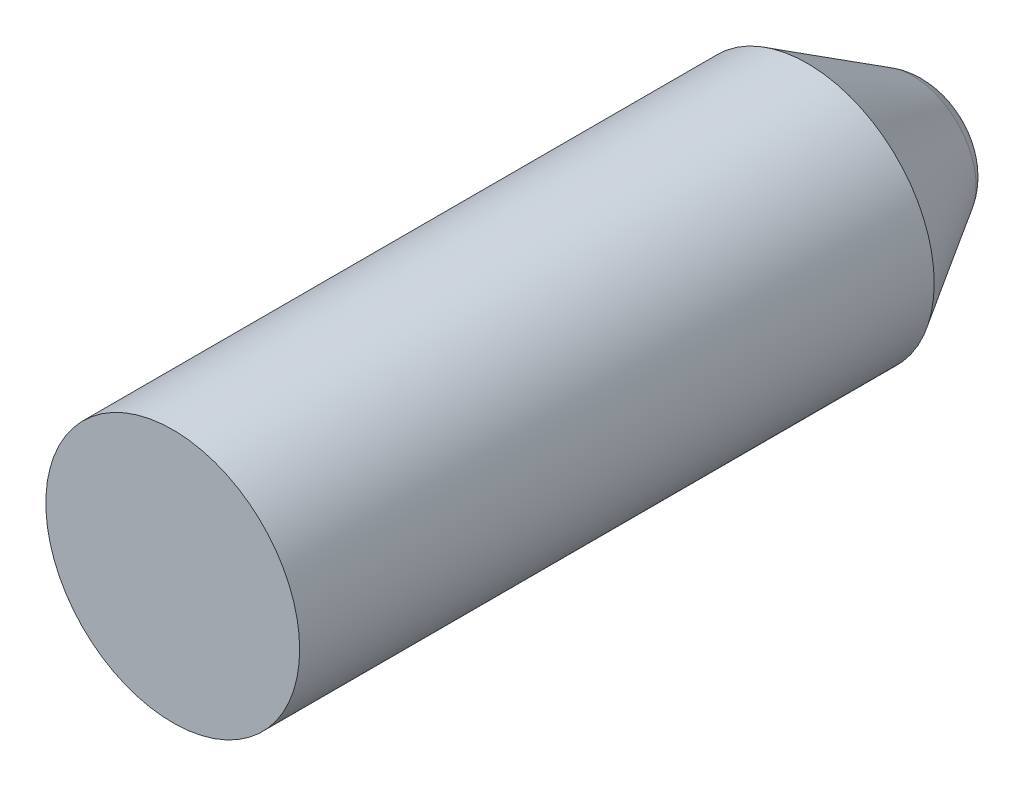
from build123d import *


with BuildPart() as part:
    # Sketch1 → Revolve1 (revolve)
    with BuildSketch(Plane(origin=(0, 0, 0), x_dir=(1, 0, 0), z_dir=(0, 1, 0))):
        with BuildLine():
            Line((0, 0), (5, 0))
            Line((5, 0), (5, 25))
            Line((5, 25), (2.5, 29.152231445))
            ThreePointArc((2.5, 29.152231445), (1.861497464, 29.773393854), (1, 30))
            Line((1, 30), (0, 30))
            Line((0, 30), (0, 0))
        make_face()
    revolve(axis=Axis((0, 0, 998.914666283), (0, 0, -1)))


solid = part.part
